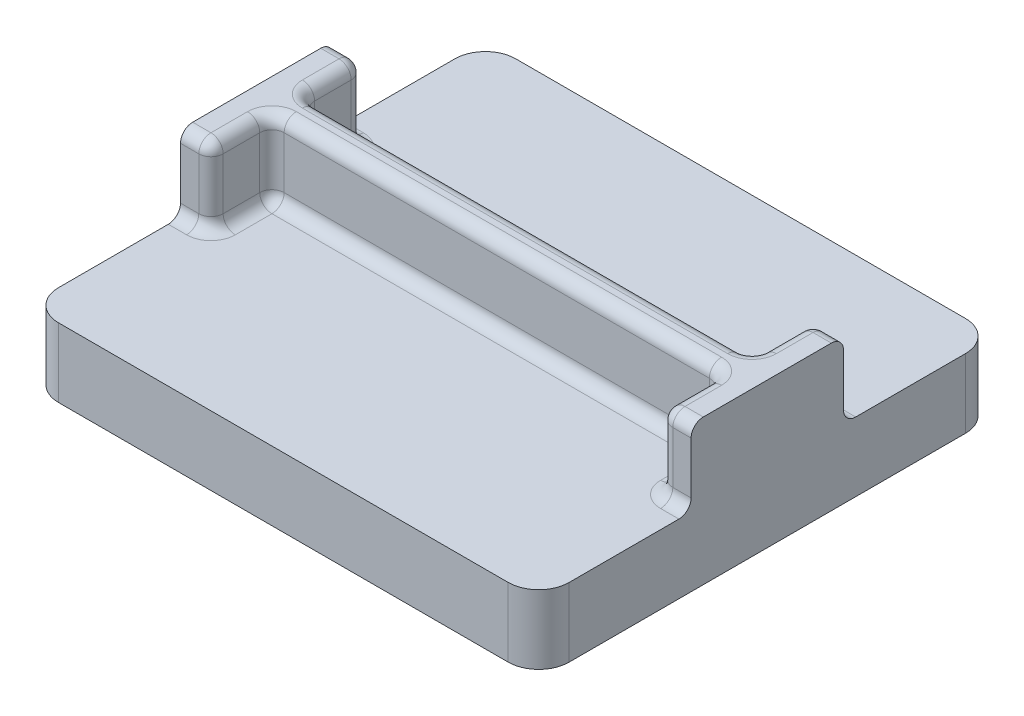
from build123d import *

# Parameters (mm, degrees)
SKETCH1_W           = 33.5
SKETCH1_H           = 30
BOSS_EXTRUDE1_DEPTH = 4.53
BOSS_EXTRUDE2_DEPTH = 5
FILLET1_R           = 2
FILLET3_R           = 0.8


with BuildPart() as part:
    # Sketch1 → Boss-Extrude1 (new body)
    with BuildSketch(Plane(origin=(0, 0, 0), x_dir=(1, 0, 0), z_dir=(0, 1, 0))):
        Rectangle(SKETCH1_W, SKETCH1_H)
    extrude(amount=BOSS_EXTRUDE1_DEPTH)

    # Sketch2 → Boss-Extrude2 (add)
    with BuildSketch(Plane(origin=(0, 4.53, 0), x_dir=(1, 0, 0), z_dir=(0, 1, 0))):
        Polygon((-14.75, 5), (-16.75, 5), (-16.75, -5), (-14.75, -5), (-14.75, -1), (14.75, -1), (14.75, -5), (16.75, -5), (16.75, 5), (14.75, 5), (14.75, 1), (-14.75, 1), align=None)
    extrude(amount=BOSS_EXTRUDE2_DEPTH)

    # Fillet1
    fillet1_edges = [part.edges().sort_by_distance(p)[0] for p in [
        (16.75, 2.265, 15),
        (-16.75, 2.265, 15),
        (-16.75, 2.265, -15),
        (16.75, 2.265, -15),
    ]]
    fillet(fillet1_edges, radius=FILLET1_R)

    # Fillet3
    fillet3_edges = [part.edges().sort_by_distance(p)[0] for p in [
        (14.75, 4.53, 3),
        (14.75, 7.03, 1),
        (15.75, 4.53, 5),
        (14.75, 7.03, 5),
        (15.75, 9.53, -5),
        (14.75, 9.53, -3),
        (14.75, 7.03, -5),
        (0, 9.53, -1),
        (14.75, 7.03, -1),
        (-14.75, 9.53, -3),
        (-14.75, 7.03, -1),
        (-15.75, 9.53, -5),
        (-14.75, 7.03, -5),
        (-15.75, 4.53, 5),
        (-14.75, 4.53, 3),
        (-14.75, 7.03, 5),
        (0, 4.53, 1),
        (-14.75, 7.03, 1),
        (14.75, 9.53, 3),
        (15.75, 9.53, 5),
        (-15.75, 9.53, 5),
        (-14.75, 9.53, 3),
        (0, 9.53, 1),
        (-15.75, 4.53, -5),
        (-14.75, 4.53, -3),
        (0, 4.53, -1),
        (14.75, 4.53, -3),
        (15.75, 4.53, -5),
    ]]
    fillet(fillet3_edges, radius=FILLET3_R)


solid = part.part
